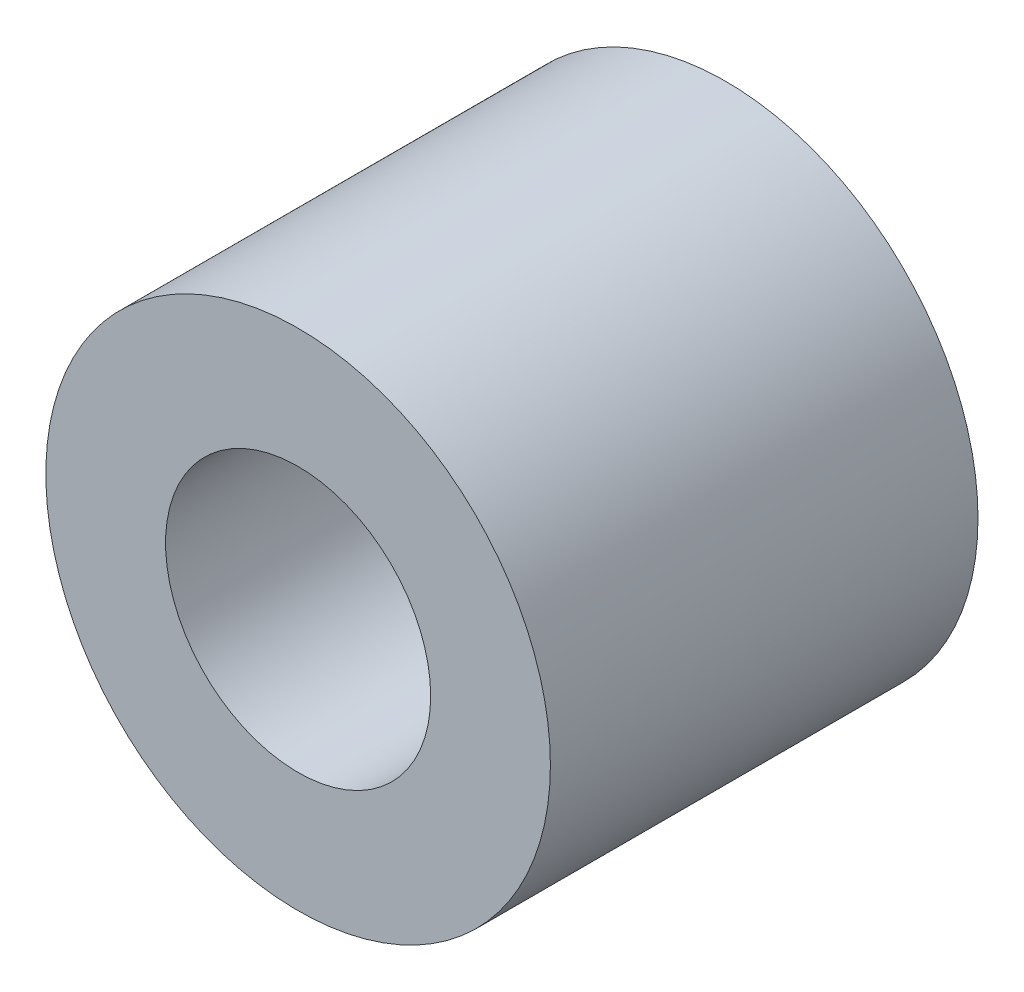
from build123d import *

# Parameters (mm, degrees)
SKETCH1_R           = 2.95
BOSS_EXTRUDE1_DEPTH = 5
SKETCH4_R           = 1.55
CUT_EXTRUDE1_DEPTH  = 7.511912162


with BuildPart() as part:
    # Sketch1 → Boss-Extrude1 (new body)
    with BuildSketch(Plane.XY):
        Circle(SKETCH1_R)
    extrude(amount=BOSS_EXTRUDE1_DEPTH)

    # Sketch4 → Cut-Extrude1 (cut, through all)
    with BuildSketch(Plane.XY.offset(5)):
        Circle(SKETCH4_R)
    extrude(amount=-CUT_EXTRUDE1_DEPTH, mode=Mode.SUBTRACT)


solid = part.part
